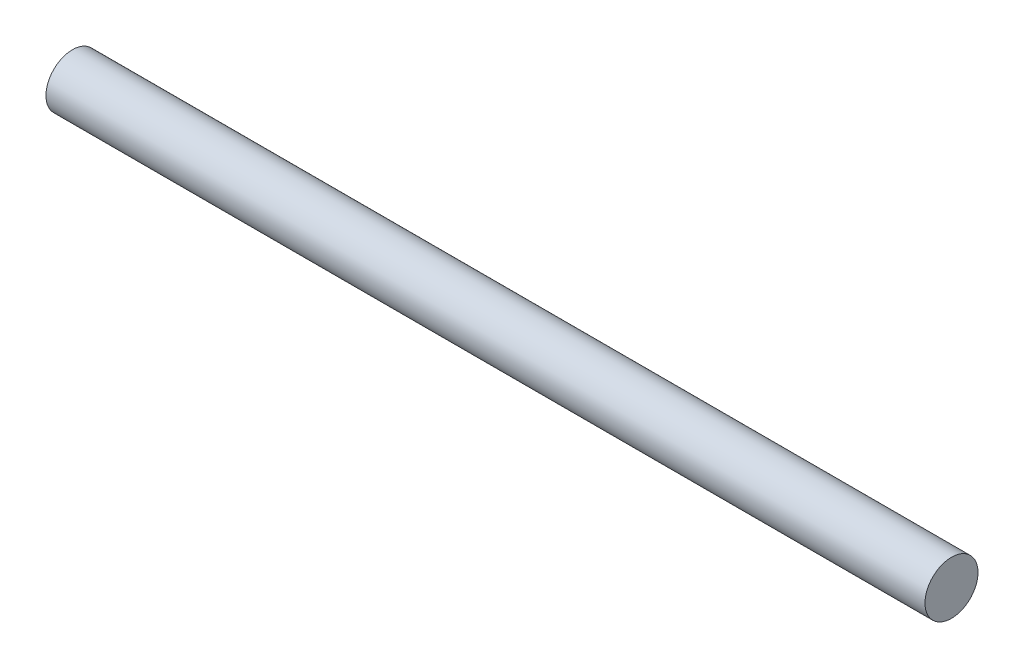
from build123d import *

# Parameters (mm, degrees)
SKETCH1_R           = 2.413
BOSS_EXTRUDE1_DEPTH = 80


with BuildPart() as part:
    # Sketch1 → Boss-Extrude1 (new body)
    with BuildSketch(Plane(origin=(0, 0, 0), x_dir=(0, 0, -1), z_dir=(1, 0, 0))):
        Circle(SKETCH1_R)
    extrude(amount=BOSS_EXTRUDE1_DEPTH)


solid = part.part
